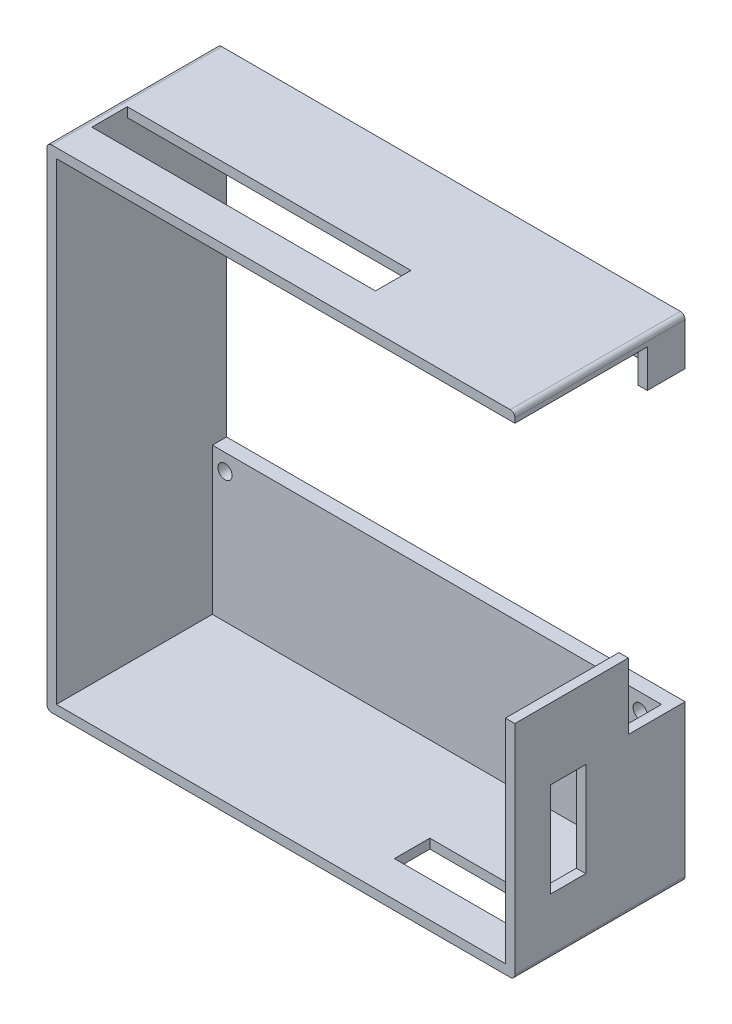
from build123d import *

# Parameters (mm, degrees)
SKETCH_1_W          = 99
SKETCH_1_H          = 104
SKETCH_1_R          = 1.5
SKETCH_1_W_2        = 95
SKETCH_1_H_2        = 61
EXTRUDE_3_DEPTH     = 3
SKETCH_3_W          = 99
SKETCH_3_H          = 104
SKETCH_3_W_2        = 95
SKETCH_3_H_2        = 100
EXTRUDE_4_DEPTH     = 33
CUT_EXTRUDE_2_DEPTH = 30
SKETCH_5_W          = 60
SKETCH_5_H          = 7.5
CUT_EXTRUDE_3_DEPTH = 30
SKETCH_6_W          = 28
SKETCH_6_H          = 55
CUT_EXTRUDE_4_DEPTH = 30
SKETCH_7_W          = 7.5
SKETCH_7_H          = 20
CUT_EXTRUDE_5_DEPTH = 30
SKETCH_8_W          = 23.5
SKETCH_8_H          = 7.5
CUT_EXTRUDE_6_DEPTH = 30
FILLET_1_R          = 1


with BuildPart() as part:
    # 草图1 → 凸台-拉伸3 (new body)
    with BuildSketch(Plane.XY):
        with Locations((0, -11.5)):
            Rectangle(SKETCH_1_W, SKETCH_1_H)
        with Locations((43, 34)):
            Circle(SKETCH_1_R, mode=Mode.SUBTRACT)
        with Locations(Location((-44.813801575, 34, 0), (0, 0, 180))):
            Circle(SKETCH_1_R, mode=Mode.SUBTRACT)
        with Locations((-44.813801575, -34)):
            Circle(SKETCH_1_R, mode=Mode.SUBTRACT)
        with Locations(Location((43, -34, 0), (0, 0, 180))):
            Circle(SKETCH_1_R, mode=Mode.SUBTRACT)
        Rectangle(SKETCH_1_W_2, SKETCH_1_H_2, mode=Mode.SUBTRACT)
    extrude(amount=EXTRUDE_3_DEPTH)

    # 草图3 → 凸台-拉伸4 (add)
    with BuildSketch(Plane.XY.offset(3)):
        with Locations((0, -11.5)):
            Rectangle(SKETCH_3_W, SKETCH_3_H)
        with Locations((0, -11.5)):
            Rectangle(SKETCH_3_W_2, SKETCH_3_H_2, mode=Mode.SUBTRACT)
    extrude(amount=EXTRUDE_4_DEPTH)

    # 草图4 → 切除-拉伸2 (cut)
    with BuildSketch(Plane.ZY.offset(-47.5)):
        Polygon((3, 30.5), (12, 30.5), (12, -30.5), (3, -30.5), (0, -30.5), (0, 30.5), align=None)
    extrude(amount=-CUT_EXTRUDE_2_DEPTH, mode=Mode.SUBTRACT)

    # 草图5 → 切除-拉伸3 (cut)
    with BuildSketch(Plane(origin=(0, 40.5, 0), x_dir=(1, 0, 0), z_dir=(0, 1, 0))):
        with Locations((-17.5, -24.75)):
            Rectangle(SKETCH_5_W, SKETCH_5_H)
    extrude(amount=-CUT_EXTRUDE_3_DEPTH, mode=Mode.SUBTRACT)

    # 草图6 → 切除-拉伸4 (cut)
    with BuildSketch(Plane.ZY.offset(-47.5)):
        with Locations((22, 11)):
            Rectangle(SKETCH_6_W, SKETCH_6_H)
    extrude(amount=-CUT_EXTRUDE_4_DEPTH, mode=Mode.SUBTRACT)

    # 草图7 → 切除-拉伸5 (cut)
    with BuildSketch(Plane.ZY.offset(-47.5)):
        with Locations((24.75, -41.5)):
            Rectangle(SKETCH_7_W, SKETCH_7_H)
    extrude(amount=-CUT_EXTRUDE_5_DEPTH, mode=Mode.SUBTRACT)

    # 草图8 → 切除-拉伸6 (cut)
    with BuildSketch(Plane(origin=(0, -61.5, 0), x_dir=(1, 0, 0), z_dir=(0, 1, 0))):
        with Locations((28.25, -24.75)):
            Rectangle(SKETCH_8_W, SKETCH_8_H)
    extrude(amount=-CUT_EXTRUDE_6_DEPTH, mode=Mode.SUBTRACT)

    # 圆角1
    fillet_1_edges = [part.edges().sort_by_distance(p)[0] for p in [
        (-49.5, 40.5, 18),
        (49.5, 40.5, 18),
        (49.5, -63.5, 18),
        (-49.5, -63.5, 18),
    ]]
    fillet(fillet_1_edges, radius=FILLET_1_R)


solid = part.part
